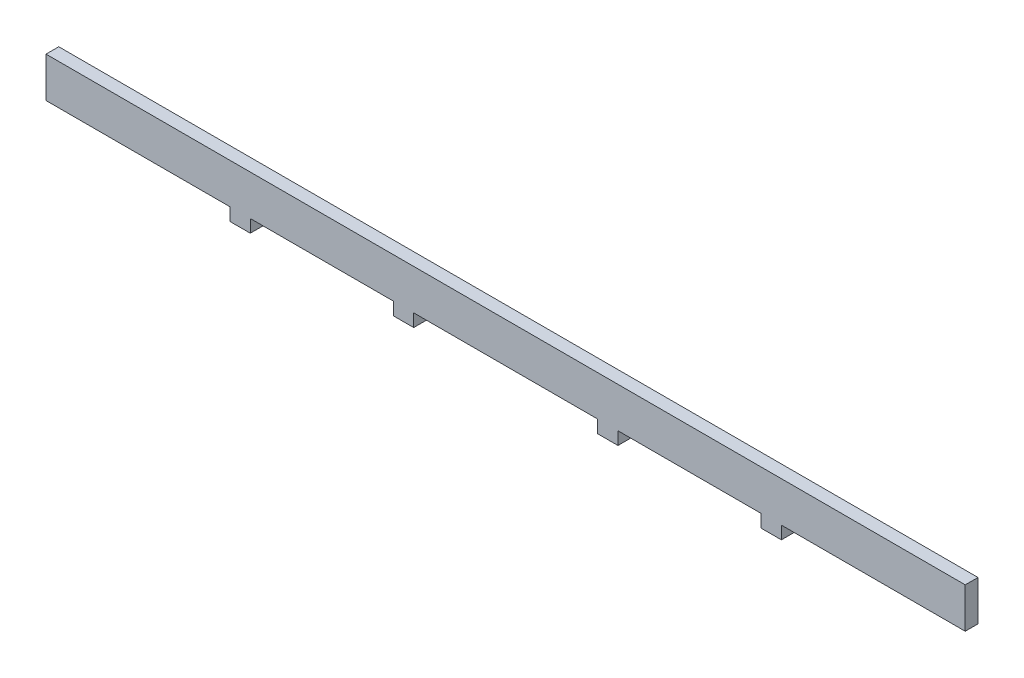
from build123d import *

# Parameters (mm, degrees)
BOSS_EXTRUDE1_DEPTH = 3.175


with BuildPart() as part:
    # Sketch1 → Boss-Extrude1 (new body)
    with BuildSketch(Plane.XY):
        Polygon((-2.267215107, 60.106814658), (-2.267215107, 56.931814658), (2.812784893, 56.931814658), (2.812784893, 60.106814658), (38.372784893, 60.106814658), (38.372784893, 56.931814658), (43.452784893, 56.931814658), (43.452784893, 60.106814658), (89.172784893, 60.106814658), (89.172784893, 70.106814658), (-139.427215107, 70.106814658), (-139.427215107, 60.106814658), (-93.707215107, 60.106814658), (-93.707215107, 56.931814658), (-88.627215107, 56.931814658), (-88.627215107, 60.106814658), (-53.067215107, 60.106814658), (-53.067215107, 56.931814658), (-47.987215107, 56.931814658), (-47.987215107, 60.106814658), align=None)
    extrude(amount=BOSS_EXTRUDE1_DEPTH)


solid = part.part
